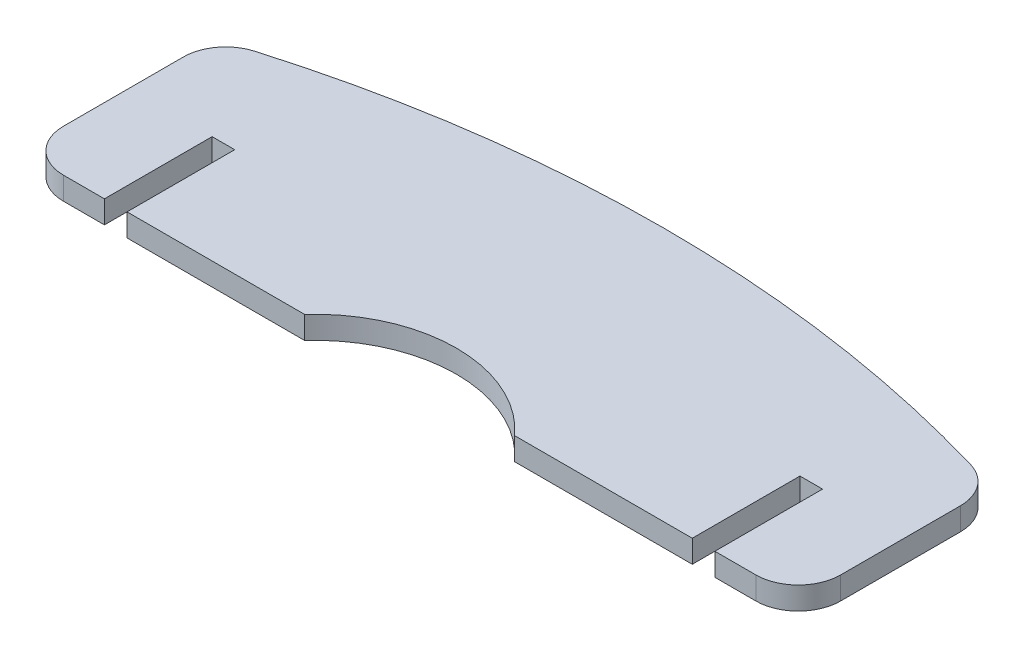
from build123d import *

# Parameters (mm, degrees)
P_IDAT_VYSUNUT_M1_DEPTH       = 0.8
SKICA3_OUTSIDE_W              = 68.578
SKICA3_OUTSIDE_H              = 31.578
ODEBRAT_VYSUNUT_M2_DEPTH      = 31.763317725
SKICA2_W                      = 1.6
SKICA2_H                      = 7.62
ODEBRAT_VYSUNUT_M1_DEPTH      = 31.763317725
ODEBRAT_VYSUNUT_M3_DEPTH      = 31.763317725
ODEBRAT_VYSUNUT_M3_DEPTH_BACK = 31.763317725


with BuildPart() as part:
    # Skica1 → Přidat vysunutím1 (new, symmetric)
    with BuildSketch(Plane(origin=(0, 0, 0), x_dir=(1, 0, 0), z_dir=(0, 1, 0))):
        with BuildLine():
            Line((-27.5, 0), (-27.5, -13.695682438))
            Line((-27.5, -13.695682438), (27.5, -13.695682438))
            Line((27.5, -13.695682438), (27.5, 0))
            ThreePointArc((27.5, 0), (0, 4.304317562), (-27.5, 0))
        make_face()
    extrude(amount=P_IDAT_VYSUNUT_M1_DEPTH, both=True)

    # Skica3 outside → Odebrat vysunutím2 (cut, through all)
    with BuildSketch(Plane(origin=(0, 0.8, 0), x_dir=(1, 0, 0), z_dir=(0, 1, 0))):
        with Locations((0, -4.696)):
            Rectangle(SKICA3_OUTSIDE_W, SKICA3_OUTSIDE_H)
        with BuildLine():
            Line((-27.5, -2.216643209), (-27.5, -10.695682438))
            ThreePointArc((-27.5, -10.695682438), (-26.621320344, -12.817002782), (-24.5, -13.695682438))
            Line((-24.5, -13.695682438), (24.5, -13.695682438))
            ThreePointArc((24.5, -13.695682438), (26.621320344, -12.817002782), (27.5, -10.695682438))
            Line((27.5, -10.695682438), (27.5, -2.216643209))
            ThreePointArc((27.5, -2.216643209), (26.901508151, -0.418655834), (25.344827599, 0.661944349))
            ThreePointArc((25.344827599, 0.661944349), (0, 4.304317562), (-25.344827599, 0.661944349))
            ThreePointArc((-25.344827599, 0.661944349), (-26.901508151, -0.418655834), (-27.5, -2.216643209))
        make_face(mode=Mode.SUBTRACT)
    extrude(amount=-ODEBRAT_VYSUNUT_M2_DEPTH, mode=Mode.SUBTRACT)

    # Skica2 → Odebrat vysunutím1 (cut, through all)
    with BuildSketch(Plane(origin=(0, 0.8, 0), x_dir=(1, 0, 0), z_dir=(0, 1, 0))):
        with Locations((-20.8, -9.885682438)):
            Rectangle(SKICA2_W, SKICA2_H)
        with Locations((20.8, -9.885682438)):
            Rectangle(SKICA2_W, SKICA2_H)
    extrude(amount=-ODEBRAT_VYSUNUT_M1_DEPTH, mode=Mode.SUBTRACT)

    # Skica6 → Odebrat vysunutím3 (cut, two sides: drawn at the far end of the back side and taken through both)
    with BuildSketch(Plane(origin=(0, 0.8, 0), x_dir=(1, 0, 0), z_dir=(0, 1, 0)).offset(-ODEBRAT_VYSUNUT_M3_DEPTH_BACK)):
        with BuildLine():
            Line((-66.724509211, -79.51573971), (-7.429758187, -13.695682438))
            ThreePointArc((-7.429758187, -13.695682438), (0, -10.388865035), (7.429758187, -13.695682438))
            Line((7.429758187, -13.695682438), (66.724509211, -79.51573971))
            Line((66.724509211, -79.51573971), (66.724509211, -256.69528072))
            Line((66.724509211, -256.69528072), (-66.724509211, -256.69528072))
            Line((-66.724509211, -256.69528072), (-66.724509211, -79.51573971))
        make_face()
    extrude(amount=ODEBRAT_VYSUNUT_M3_DEPTH + ODEBRAT_VYSUNUT_M3_DEPTH_BACK, mode=Mode.SUBTRACT)


solid = part.part
